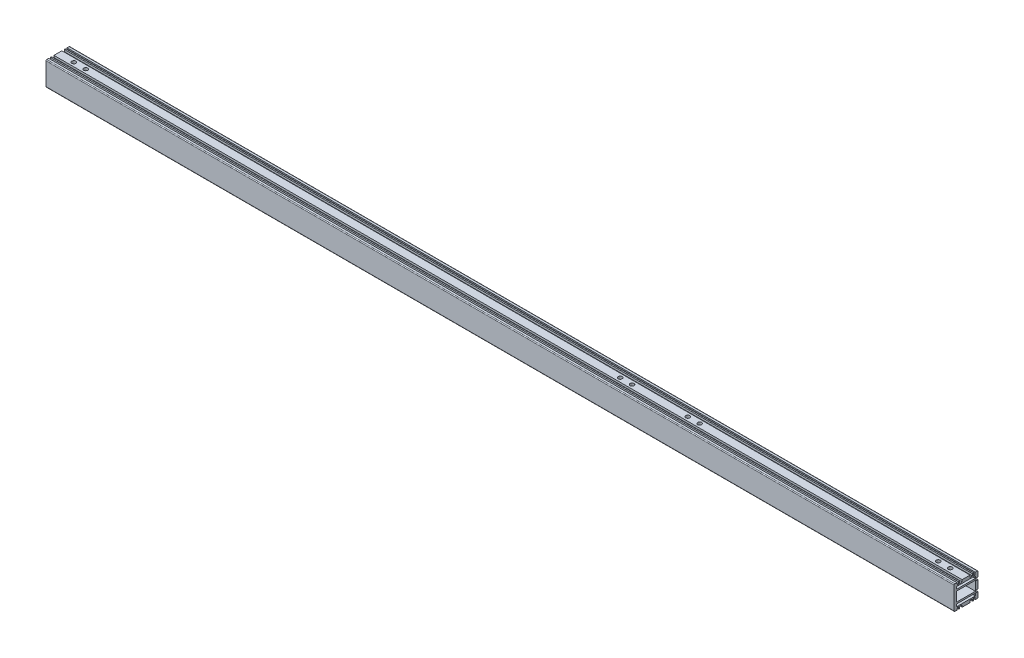
from build123d import *

# Parameters (mm, degrees)
SKETCH_1_W             = 23.5
SKETCH_1_H             = 12
EXTRUDE_1_DEPTH        = 571
HOLE_WIZARD_M6_1_D     = 5
HOLE_WIZARD_M6_1_DEPTH = 15
HOLE_WIZARD_M6_1_TIP   = 1.502151548
HOLE_WIZARD_M6_2_D     = 5
HOLE_WIZARD_M6_2_DEPTH = 15
HOLE_WIZARD_M6_2_TIP   = 1.502151548
HOLE_WIZARD_M4_1_D     = 3.3
HOLE_WIZARD_M4_1_DEPTH = 10.1
HOLE_WIZARD_M4_1_TIP   = 0.991420021
HOLE_WIZARD_M6_3_D     = 5
HOLE_WIZARD_M6_3_DEPTH = 15
HOLE_WIZARD_M6_3_TIP   = 1.502151548


with BuildPart() as part:
    # 草图1 → 凸台-拉伸1 (new, symmetric)
    with BuildSketch(Plane(origin=(0, 0, 0), x_dir=(0, 0, -1), z_dir=(1, 0, 0))):
        with BuildLine():
            Line((-14, 15), (-11.5, 15))
            Line((-11.5, 15), (-11.5, 13.5))
            Line((-11.5, 13.5), (-11.4, 13.5))
            ThreePointArc((-11.4, 13.5), (-11.117157288, 13.382842712), (-11, 13.1))
            Line((-11, 13.1), (-11, 12))
            Line((-11, 12), (-9.5, 12))
            Line((-9.5, 12), (-9.5, 15))
            Line((-9.5, 15), (-8, 15))
            Line((-8, 15), (-8, 12.5))
            Line((-8, 12.5), (-5, 12.5))
            Line((-5, 12.5), (-5, 15))
            Line((-5, 15), (5, 15))
            Line((5, 15), (5, 12.5))
            Line((5, 12.5), (8, 12.5))
            Line((8, 12.5), (8, 15))
            Line((8, 15), (9.5, 15))
            Line((9.5, 15), (9.5, 12))
            Line((9.5, 12), (11, 12))
            Line((11, 12), (11, 13.1))
            ThreePointArc((11, 13.1), (11.117157288, 13.382842712), (11.4, 13.5))
            Line((11.4, 13.5), (11.5, 13.5))
            Line((11.5, 13.5), (11.5, 15))
            Line((11.5, 15), (14, 15))
            ThreePointArc((14, 15), (14.707106781, 14.707106781), (15, 14))
            Line((15, 14), (15, 8))
            Line((15, 8), (12.5, 8))
            Line((12.5, 8), (12.5, 5))
            Line((12.5, 5), (15, 5))
            Line((15, 5), (15, -5))
            Line((15, -5), (12.5, -5))
            Line((12.5, -5), (12.5, -8))
            Line((12.5, -8), (15, -8))
            Line((15, -8), (15, -14))
            ThreePointArc((15, -14), (14.707106781, -14.707106781), (14, -15))
            Line((14, -15), (11.5, -15))
            Line((11.5, -15), (11.5, -13.5))
            Line((11.5, -13.5), (11.4, -13.5))
            ThreePointArc((11.4, -13.5), (11.117157288, -13.382842712), (11, -13.1))
            Line((11, -13.1), (11, -12))
            Line((11, -12), (9.5, -12))
            Line((9.5, -12), (9.5, -15))
            Line((9.5, -15), (8, -15))
            Line((8, -15), (8, -12.5))
            Line((8, -12.5), (5, -12.5))
            Line((5, -12.5), (5, -15))
            Line((5, -15), (-5, -15))
            Line((-5, -15), (-5, -12.5))
            Line((-5, -12.5), (-8, -12.5))
            Line((-8, -12.5), (-8, -15))
            Line((-8, -15), (-9.5, -15))
            Line((-9.5, -15), (-9.5, -12))
            Line((-9.5, -12), (-11, -12))
            Line((-11, -12), (-11, -13.1))
            ThreePointArc((-11, -13.1), (-11.117157288, -13.382842712), (-11.4, -13.5))
            Line((-11.4, -13.5), (-11.5, -13.5))
            Line((-11.5, -13.5), (-11.5, -15))
            Line((-11.5, -15), (-14, -15))
            ThreePointArc((-14, -15), (-14.707106781, -14.707106781), (-15, -14))
            Line((-15, -14), (-15, 14))
            ThreePointArc((-15, 14), (-14.707106781, 14.707106781), (-14, 15))
        make_face()
        with BuildLine():
            Line((12, -10.5), (12, -8.5))
            ThreePointArc((12, -8.5), (11.853553391, -8.146446609), (11.5, -8))
            Line((11.5, -8), (-11.5, -8))
            ThreePointArc((-11.5, -8), (-11.853553391, -8.146446609), (-12, -8.5))
            Line((-12, -8.5), (-12, -10.5))
            ThreePointArc((-12, -10.5), (-11.853553391, -10.853553391), (-11.5, -11))
            Line((-11.5, -11), (11.5, -11))
            ThreePointArc((11.5, -11), (11.853553391, -10.853553391), (12, -10.5))
        make_face(mode=Mode.SUBTRACT)
        with BuildLine():
            Line((-11.5, 11), (11.5, 11))
            ThreePointArc((11.5, 11), (11.853553391, 10.853553391), (12, 10.5))
            Line((12, 10.5), (12, 8.5))
            ThreePointArc((12, 8.5), (11.853553391, 8.146446609), (11.5, 8))
            Line((11.5, 8), (-11.5, 8))
            ThreePointArc((-11.5, 8), (-11.853553391, 8.146446609), (-12, 8.5))
            Line((-12, 8.5), (-12, 10.5))
            ThreePointArc((-12, 10.5), (-11.853553391, 10.853553391), (-11.5, 11))
        make_face(mode=Mode.SUBTRACT)
        Rectangle(SKETCH_1_W, SKETCH_1_H, mode=Mode.SUBTRACT)
    extrude(amount=EXTRUDE_1_DEPTH, both=True)

    # M6 螺纹孔1
    with Locations(Plane.XZ.offset(15)):
        with Locations((551, 0), (536, 0), (-536, 0), (-551, 0)):
            Hole(HOLE_WIZARD_M6_1_D / 2, depth=HOLE_WIZARD_M6_1_DEPTH)
            with Locations((0, 0, -(HOLE_WIZARD_M6_1_DEPTH + HOLE_WIZARD_M6_1_TIP / 2))):  # 118° drill point
                Cone(0, HOLE_WIZARD_M6_1_D / 2, HOLE_WIZARD_M6_1_TIP, mode=Mode.SUBTRACT)

    # M6 螺纹孔2
    with Locations(Plane(origin=(0, 15, 0), x_dir=(-1, 0, 0), z_dir=(0, 1, 0))):
        with Locations((551, 0), (536, 0), (-151, 0), (-136, 0), (-221, 0), (-236, 0), (-536, 0), (-551, 0)):
            Hole(HOLE_WIZARD_M6_2_D / 2, depth=HOLE_WIZARD_M6_2_DEPTH)
            with Locations((0, 0, -(HOLE_WIZARD_M6_2_DEPTH + HOLE_WIZARD_M6_2_TIP / 2))):  # 118° drill point
                Cone(0, HOLE_WIZARD_M6_2_D / 2, HOLE_WIZARD_M6_2_TIP, mode=Mode.SUBTRACT)

    # M4 螺纹孔1
    with Locations(Plane.XZ.offset(15)):
        with Locations((479, 0), (319, 0), (159, 0), (-1, 0), (-161, 0), (-321, 0), (-481, 0)):
            Hole(HOLE_WIZARD_M4_1_D / 2, depth=HOLE_WIZARD_M4_1_DEPTH)
            with Locations((0, 0, -(HOLE_WIZARD_M4_1_DEPTH + HOLE_WIZARD_M4_1_TIP / 2))):  # 118° drill point
                Cone(0, HOLE_WIZARD_M4_1_D / 2, HOLE_WIZARD_M4_1_TIP, mode=Mode.SUBTRACT)

    # M6 螺纹孔3
    with Locations(Plane(origin=(0, 0, -15), x_dir=(-1, 0, 0), z_dir=(0, 0, -1))):
        with Locations((-293.5, 0), (-218.5, 0)):
            Hole(HOLE_WIZARD_M6_3_D / 2, depth=HOLE_WIZARD_M6_3_DEPTH)
            with Locations((0, 0, -(HOLE_WIZARD_M6_3_DEPTH + HOLE_WIZARD_M6_3_TIP / 2))):  # 118° drill point
                Cone(0, HOLE_WIZARD_M6_3_D / 2, HOLE_WIZARD_M6_3_TIP, mode=Mode.SUBTRACT)


solid = part.part
